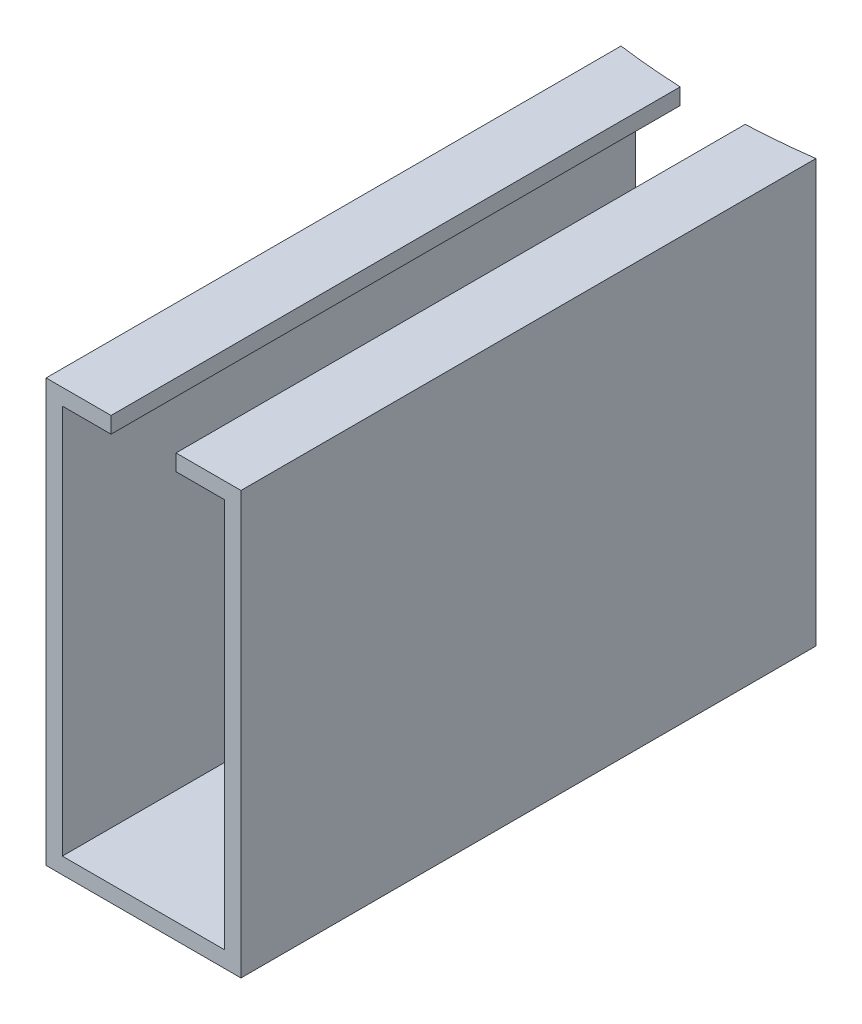
from build123d import *

# Parameters (mm, degrees)
EXTRUDE_1_DEPTH     = 40
SKETCH_2_R          = 22.5
CUT_EXTRUDE_1_DEPTH = 40


with BuildPart() as part:
    # ｽｹｯﾁ1 → ﾎﾞｽ - 押し出し1 (new body)
    with BuildSketch(Plane.XY):
        Polygon((0, 0), (5, 0), (5, 12), (3.5, 12), (3.5, 12.5), (5.5, 12.5), (5.5, 12), (5.5, -0.5), (-0.5, -0.5), (-0.5, 12), (-0.5, 12.5), (1.5, 12.5), (1.5, 12), (0, 12), align=None)
    extrude(amount=EXTRUDE_1_DEPTH)

    # ｽｹｯﾁ2 → ｶｯﾄ - 押し出し1 (cut)
    with BuildSketch(Plane.XZ.offset(0.5)):
        with Locations((2.5, 0)):
            Circle(SKETCH_2_R)
    extrude(amount=-CUT_EXTRUDE_1_DEPTH, mode=Mode.SUBTRACT)


solid = part.part
